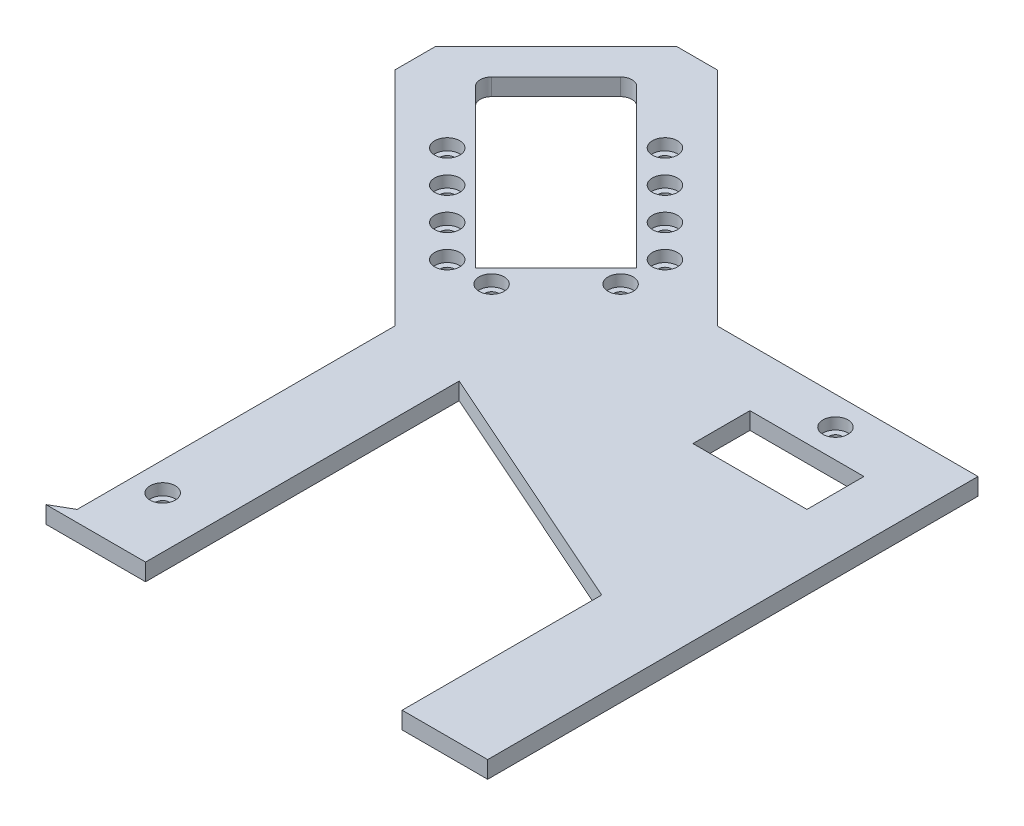
from build123d import *

# Parameters (mm, degrees)
EXTRUDE_1_DEPTH              = 3
CUT_EXTRUDE_1_REACH          = 217.134
HOLE_WIZARD_M2_2_D           = 2.4
HOLE_WIZARD_M2_2_CBORE_D     = 4.4
HOLE_WIZARD_M2_2_CBORE_DEPTH = 2
CUT_EXTRUDE_2_REACH          = 217.134
HOLE_WIZARD_M2_3_D           = 2.4
HOLE_WIZARD_M2_3_CBORE_D     = 4.4
HOLE_WIZARD_M2_3_CBORE_DEPTH = 2
MIRROR_7_COPY_1_REACH        = 217.134
MIRROR_7_COPY_2_D            = 2.4
MIRROR_7_COPY_2_CBORE_D      = 4.4
MIRROR_7_COPY_2_CBORE_DEPTH  = 2
CUT_EXTRUDE_3_REACH          = 217.134
SKETCH_18_W                  = 20
SKETCH_18_H                  = 10
HOLE_WIZARD_M2_4_D           = 2.4
HOLE_WIZARD_M2_4_CBORE_D     = 4.4
HOLE_WIZARD_M2_4_CBORE_DEPTH = 2
HOLE_WIZARD_M2_5_D           = 2.4
HOLE_WIZARD_M2_5_CBORE_D     = 4.4
HOLE_WIZARD_M2_5_CBORE_DEPTH = 2
HOLE_WIZARD_M2_6_D           = 2.4
HOLE_WIZARD_M2_6_CBORE_D     = 4.4
HOLE_WIZARD_M2_6_CBORE_DEPTH = 2
SKETCH_24_W                  = 20
SKETCH_24_H                  = 56
CUT_EXTRUDE_4_DEPTH          = 10
HOLE_WIZARD_M2_7_D           = 2.4
HOLE_WIZARD_M2_7_CBORE_D     = 4.4
HOLE_WIZARD_M2_7_CBORE_DEPTH = 2
SKETCH_26_OUTSIDE_W          = 390.69
SKETCH_26_OUTSIDE_H          = 393.83
SKETCH_26_OUTSIDE_W_2        = 112.890872965
SKETCH_26_OUTSIDE_H_2        = 124.890872965
CUT_EXTRUDE_5_DEPTH          = 10


with BuildPart() as part:
    # 草图1 → 凸台-拉伸1 (new body)
    with BuildSketch(Plane(origin=(0, 0, 0), x_dir=(1, 0, 0), z_dir=(0, 1, 0))):
        Polygon((-45.715728753, 114), (45.715728753, 114), (84.606601718, 152.890872965), (91.67766953, 152.890872965), (112.890872965, 131.67766953), (112.890872965, 124.606601718), (74, 85.715728753), (74, 30), (91.320508076, 20), (146.320508076, 20), (151.320508076, 15), (151.320508076, -15), (146.320508076, -20), (91.320508076, -20), (74, -30), (74, -85.715728753), (112.890872965, -124.606601718), (112.890872965, -131.67766953), (91.67766953, -152.890872965), (84.606601718, -152.890872965), (45.715728753, -114), (-45.715728753, -114), (-84.606601718, -152.890872965), (-91.67766953, -152.890872965), (-112.890872965, -131.67766953), (-112.890872965, -124.606601718), (-74, -85.715728753), (-74, -30), (-91.320508076, -20), (-146.320508076, -20), (-151.320508076, -15), (-151.320508076, 15), (-146.320508076, 20), (-91.320508076, 20), (-74, 30), (-74, 85.715728753), (-112.890872965, 124.606601718), (-112.890872965, 131.67766953), (-91.67766953, 152.890872965), (-84.606601718, 152.890872965), align=None)
    extrude(amount=EXTRUDE_1_DEPTH)

    # 草图2 → 切除-拉伸1 (cut, up to next)
    with BuildSketch(Plane(origin=(0, 3, 0), x_dir=(1, 0, 0), z_dir=(0, 1, 0)), mode=Mode.PRIVATE) as cut_extrude_1_sk1:
        with BuildLine():
            Line((103.820508076, -10), (103.820508076, 10))
            Line((103.820508076, 10), (142.820508076, 10))
            ThreePointArc((142.820508076, 10), (144.234721638, 9.414213562), (144.820508076, 8))
            Line((144.820508076, 8), (144.820508076, -8))
            ThreePointArc((144.820508076, -8), (144.234721638, -9.414213562), (142.820508076, -10))
            Line((142.820508076, -10), (103.820508076, -10))
        make_face()
    cut_extrude_1_tool1 = extrude(cut_extrude_1_sk1.sketch, amount=-CUT_EXTRUDE_1_REACH, mode=Mode.PRIVATE) & part.part
    cut_extrude_1 = cut_extrude_1_tool1.solids().sort_by_distance((124.278435, 3, 0))[0]
    add(cut_extrude_1, mode=Mode.SUBTRACT)

    # M2 凹头盖螺钉的柱形沉头孔2 (through all)
    with Locations(Plane(origin=(100.320508076, 3, -8), x_dir=(0, 0, 1), z_dir=(0, 1, 0))):
        with Locations((0, 0), (-5.5, 5.25), (-5.5, 13.25), (-5.5, 21.25), (-5.5, 29.25), (16, 0), (21.5, 5.25), (21.5, 13.25), (21.5, 21.25), (21.5, 29.25)):
            hole_wizard_m2_2 = CounterBoreHole(HOLE_WIZARD_M2_2_D / 2, HOLE_WIZARD_M2_2_CBORE_D / 2, HOLE_WIZARD_M2_2_CBORE_DEPTH)

    # 草图10 → 切除-拉伸2 (cut, up to next)
    with BuildSketch(Plane(origin=(0, 3, 0), x_dir=(1, 0, 0), z_dir=(0, 1, 0)), mode=Mode.PRIVATE) as cut_extrude_2_sk1:
        with BuildLine():
            Line((75.767766953, 101.625631329), (61.625631329, 115.767766953))
            Line((61.625631329, 115.767766953), (79.916185958, 134.058321582))
            Line((79.916185958, 134.058321582), (89.202795796, 143.344931419))
            ThreePointArc((89.202795796, 143.344931419), (90.617009358, 143.930717857), (92.03122292, 143.344931419))
            Line((92.03122292, 143.344931419), (97.68807717, 137.68807717))
            Line((97.68807717, 137.68807717), (103.344931419, 132.03122292))
            ThreePointArc((103.344931419, 132.03122292), (103.930717857, 130.617009358), (103.344931419, 129.202795796))
            Line((103.344931419, 129.202795796), (94.058321582, 119.916185958))
            Line((94.058321582, 119.916185958), (75.767766953, 101.625631329))
        make_face()
    cut_extrude_2_tool1 = extrude(cut_extrude_2_sk1.sketch, amount=-CUT_EXTRUDE_2_REACH, mode=Mode.PRIVATE) & part.part
    cut_extrude_2 = cut_extrude_2_tool1.solids().sort_by_distance((83.162638, 3, -123.162638))[0]
    add(cut_extrude_2, mode=Mode.SUBTRACT)

    # M2 凹头盖螺钉的柱形沉头孔3 (through all)
    with Locations(Plane(origin=(60.388194462, 3, -119.480077554), x_dir=(0, 0, 1), z_dir=(0, 1, 0))):
        with Locations((0, 0), (-5.65685425, 5.65685425), (-11.313708499, 11.313708499), (-16.970562749, 16.970562749), (7.601397898, 0.176776695), (18.915106397, 11.490485194), (19.091883092, 19.091883092), (13.435028842, 24.748737342), (7.778174593, 30.405591591), (2.121320343, 36.062445841)):
            hole_wizard_m2_3 = CounterBoreHole(HOLE_WIZARD_M2_3_D / 2, HOLE_WIZARD_M2_3_CBORE_D / 2, HOLE_WIZARD_M2_3_CBORE_DEPTH)

    # 镜向5: 切除-拉伸1, M2 凹头盖螺钉的柱形沉头孔2 across plane
    add(cut_extrude_1.mirror(Plane(origin=(0, 0, 0), x_dir=(0, 0, 1), z_dir=(1, 0, 0))), mode=Mode.SUBTRACT)
    add(hole_wizard_m2_2.mirror(Plane(origin=(0, 0, 0), x_dir=(0, 0, 1), z_dir=(1, 0, 0))), mode=Mode.SUBTRACT)

    # 镜向6: 切除-拉伸2, M2 凹头盖螺钉的柱形沉头孔3 across plane
    add(cut_extrude_2.mirror(Plane(origin=(0, 0, 0), x_dir=(0, 0, 1), z_dir=(1, 0, 0))), mode=Mode.SUBTRACT)
    add(hole_wizard_m2_3.mirror(Plane(origin=(0, 0, 0), x_dir=(0, 0, 1), z_dir=(1, 0, 0))), mode=Mode.SUBTRACT)

    # 镜向7: 切除-拉伸2, M2 凹头盖螺钉的柱形沉头孔3 across plane
    add(cut_extrude_2.mirror(Plane.XY), mode=Mode.SUBTRACT)
    add(hole_wizard_m2_3.mirror(Plane.XY), mode=Mode.SUBTRACT)

    # 镜向7 copy 1 sketch → 镜向7 copy 1 (cut, up to next)
    with BuildSketch(Plane(origin=(0, 3, 0), x_dir=(-1, 0, 0), z_dir=(0, 1, 0)), mode=Mode.PRIVATE) as mirror_7_copy_1_sk1:
        with BuildLine():
            Line((75.767766953, 101.625631329), (61.625631329, 115.767766953))
            Line((61.625631329, 115.767766953), (79.916185958, 134.058321582))
            Line((79.916185958, 134.058321582), (89.202795796, 143.344931419))
            ThreePointArc((89.202795796, 143.344931419), (90.617009358, 143.930717857), (92.03122292, 143.344931419))
            Line((92.03122292, 143.344931419), (97.68807717, 137.68807717))
            Line((97.68807717, 137.68807717), (103.344931419, 132.03122292))
            ThreePointArc((103.344931419, 132.03122292), (103.930717857, 130.617009358), (103.344931419, 129.202795796))
            Line((103.344931419, 129.202795796), (94.058321582, 119.916185958))
            Line((94.058321582, 119.916185958), (75.767766953, 101.625631329))
        make_face()
    mirror_7_copy_1_tool1 = extrude(mirror_7_copy_1_sk1.sketch, amount=-MIRROR_7_COPY_1_REACH, mode=Mode.PRIVATE) & part.part
    add(mirror_7_copy_1_tool1.solids().sort_by_distance((-83.162638, 3, 123.162638))[0], mode=Mode.SUBTRACT)

    # 镜向7 copy 2 (through all)
    with Locations(Plane(origin=(-60.388194462, 3, 119.480077554), x_dir=(0, 0, -1), z_dir=(0, 1, 0))):
        with Locations((0, 0), (-5.65685425, 5.65685425), (-11.313708499, 11.313708499), (-16.970562749, 16.970562749), (7.601397898, 0.176776695), (18.915106397, 11.490485194), (19.091883092, 19.091883092), (13.435028842, 24.748737342), (7.778174593, 30.405591591), (2.121320343, 36.062445841)):
            CounterBoreHole(MIRROR_7_COPY_2_D / 2, MIRROR_7_COPY_2_CBORE_D / 2, MIRROR_7_COPY_2_CBORE_DEPTH)

    # 草图18 → 切除-拉伸3 (cut, up to next)
    with BuildSketch(Plane(origin=(0, 3, 0), x_dir=(1, 0, 0), z_dir=(0, 1, 0)), mode=Mode.PRIVATE) as cut_extrude_3_sk1:
        Polygon((-60, -28), (-15, -28), (-15, -63), (-60, -83), align=None)
    cut_extrude_3_tool1 = extrude(cut_extrude_3_sk1.sketch, amount=-CUT_EXTRUDE_3_REACH, mode=Mode.PRIVATE) & part.part
    # 草图18 → 切除-拉伸3 (cut, up to next)
    with BuildSketch(Plane(origin=(0, 3, 0), x_dir=(1, 0, 0), z_dir=(0, 1, 0)), mode=Mode.PRIVATE) as cut_extrude_3_sk2:
        with Locations((20, -99)):
            Rectangle(SKETCH_18_W, SKETCH_18_H)
    cut_extrude_3_tool2 = extrude(cut_extrude_3_sk2.sketch, amount=-CUT_EXTRUDE_3_REACH, mode=Mode.PRIVATE) & part.part
    # 草图18 → 切除-拉伸3 (cut, up to next)
    with BuildSketch(Plane(origin=(0, 3, 0), x_dir=(1, 0, 0), z_dir=(0, 1, 0)), mode=Mode.PRIVATE) as cut_extrude_3_sk3:
        with Locations((-20, -99)):
            Rectangle(SKETCH_18_W, SKETCH_18_H)
    cut_extrude_3_tool3 = extrude(cut_extrude_3_sk3.sketch, amount=-CUT_EXTRUDE_3_REACH, mode=Mode.PRIVATE) & part.part
    # 草图18 → 切除-拉伸3 (cut, up to next)
    with BuildSketch(Plane(origin=(0, 3, 0), x_dir=(1, 0, 0), z_dir=(0, 1, 0)), mode=Mode.PRIVATE) as cut_extrude_3_sk4:
        Polygon((15, -63), (60, -83), (60, -28), (15, -28), align=None)
    cut_extrude_3_tool4 = extrude(cut_extrude_3_sk4.sketch, amount=-CUT_EXTRUDE_3_REACH, mode=Mode.PRIVATE) & part.part
    # 草图18 → 切除-拉伸3 (cut, up to next)
    with BuildSketch(Plane(origin=(0, 3, 0), x_dir=(1, 0, 0), z_dir=(0, 1, 0)), mode=Mode.PRIVATE) as cut_extrude_3_sk5:
        with Locations((-20, 99)):
            Rectangle(SKETCH_18_W, SKETCH_18_H)
    cut_extrude_3_tool5 = extrude(cut_extrude_3_sk5.sketch, amount=-CUT_EXTRUDE_3_REACH, mode=Mode.PRIVATE) & part.part
    # 草图18 → 切除-拉伸3 (cut, up to next)
    with BuildSketch(Plane(origin=(0, 3, 0), x_dir=(1, 0, 0), z_dir=(0, 1, 0)), mode=Mode.PRIVATE) as cut_extrude_3_sk6:
        with Locations((20, 99)):
            Rectangle(SKETCH_18_W, SKETCH_18_H)
    cut_extrude_3_tool6 = extrude(cut_extrude_3_sk6.sketch, amount=-CUT_EXTRUDE_3_REACH, mode=Mode.PRIVATE) & part.part
    # 草图18 → 切除-拉伸3 (cut, up to next)
    with BuildSketch(Plane(origin=(0, 3, 0), x_dir=(1, 0, 0), z_dir=(0, 1, 0)), mode=Mode.PRIVATE) as cut_extrude_3_sk7:
        Polygon((15, 63), (60, 83), (60, 28), (15, 28), align=None)
    cut_extrude_3_tool7 = extrude(cut_extrude_3_sk7.sketch, amount=-CUT_EXTRUDE_3_REACH, mode=Mode.PRIVATE) & part.part
    # 草图18 → 切除-拉伸3 (cut, up to next)
    with BuildSketch(Plane(origin=(0, 3, 0), x_dir=(1, 0, 0), z_dir=(0, 1, 0)), mode=Mode.PRIVATE) as cut_extrude_3_sk8:
        Polygon((-15, 28), (-15, 63), (-60, 83), (-60, 28), align=None)
    cut_extrude_3_tool8 = extrude(cut_extrude_3_sk8.sketch, amount=-CUT_EXTRUDE_3_REACH, mode=Mode.PRIVATE) & part.part
    add(cut_extrude_3_tool1.solids().sort_by_distance((-39.166667, 3, 50.87037))[0], mode=Mode.SUBTRACT)
    add(cut_extrude_3_tool2.solids().sort_by_distance((20, 3, 99))[0], mode=Mode.SUBTRACT)
    add(cut_extrude_3_tool3.solids().sort_by_distance((-20, 3, 99))[0], mode=Mode.SUBTRACT)
    add(cut_extrude_3_tool4.solids().sort_by_distance((39.166667, 3, 50.87037))[0], mode=Mode.SUBTRACT)
    add(cut_extrude_3_tool5.solids().sort_by_distance((-20, 3, -99))[0], mode=Mode.SUBTRACT)
    add(cut_extrude_3_tool6.solids().sort_by_distance((20, 3, -99))[0], mode=Mode.SUBTRACT)
    add(cut_extrude_3_tool7.solids().sort_by_distance((39.166667, 3, -50.87037))[0], mode=Mode.SUBTRACT)
    add(cut_extrude_3_tool8.solids().sort_by_distance((-39.166667, 3, -50.87037))[0], mode=Mode.SUBTRACT)

    # M2 凹头盖螺钉的柱形沉头孔4 (through all)
    with Locations(Plane(origin=(-20, 3, 109), x_dir=(0, 0, 1), z_dir=(0, 1, 0))):
        with Locations((0, 0), (0, 40), (-218, 0), (-218, 40)):
            CounterBoreHole(HOLE_WIZARD_M2_4_D / 2, HOLE_WIZARD_M2_4_CBORE_D / 2, HOLE_WIZARD_M2_4_CBORE_DEPTH)

    # M2 凹头盖螺钉的柱形沉头孔5 (through all)
    with Locations(Plane(origin=(-69, 3, -40), x_dir=(0, 0, 1), z_dir=(0, 1, 0))):
        with Locations((0, 0), (0, 138)):
            hole_wizard_m2_5 = CounterBoreHole(HOLE_WIZARD_M2_5_D / 2, HOLE_WIZARD_M2_5_CBORE_D / 2, HOLE_WIZARD_M2_5_CBORE_DEPTH)

    # 镜向8: M2 凹头盖螺钉的柱形沉头孔5 across plane
    add(hole_wizard_m2_5.mirror(Plane.XY), mode=Mode.SUBTRACT)

    # M2 凹头盖螺钉的柱形沉头孔6 (through all)
    with Locations(Plane(origin=(-69, 3, 0), x_dir=(0, 0, 1), z_dir=(0, 1, 0))):
        with Locations((0, 0), (0, 138)):
            CounterBoreHole(HOLE_WIZARD_M2_6_D / 2, HOLE_WIZARD_M2_6_CBORE_D / 2, HOLE_WIZARD_M2_6_CBORE_DEPTH)

    # 草图24 → 切除-拉伸4 (cut)
    with BuildSketch(Plane(origin=(0, 3, 0), x_dir=(1, 0, 0), z_dir=(0, 1, 0))):
        Rectangle(SKETCH_24_W, SKETCH_24_H)
    extrude(amount=-CUT_EXTRUDE_4_DEPTH, mode=Mode.SUBTRACT)

    # M2 凹头盖螺钉的柱形沉头孔7 (through all)
    with Locations(Plane(origin=(-20, 3, 0), x_dir=(0, 0, 1), z_dir=(0, 1, 0))):
        with Locations((0, 0), (0, 40)):
            CounterBoreHole(HOLE_WIZARD_M2_7_D / 2, HOLE_WIZARD_M2_7_CBORE_D / 2, HOLE_WIZARD_M2_7_CBORE_DEPTH)

    # 草图26 outside → 切除-拉伸5 (cut)
    with BuildSketch(Plane(origin=(0, 3, 0), x_dir=(1, 0, 0), z_dir=(0, 1, 0))):
        Rectangle(SKETCH_26_OUTSIDE_W, SKETCH_26_OUTSIDE_H)
        with Locations((-56.445436483, 90.445436482)):
            Rectangle(SKETCH_26_OUTSIDE_W_2, SKETCH_26_OUTSIDE_H_2, mode=Mode.SUBTRACT)
    extrude(amount=-CUT_EXTRUDE_5_DEPTH, mode=Mode.SUBTRACT)


solid = part.part
